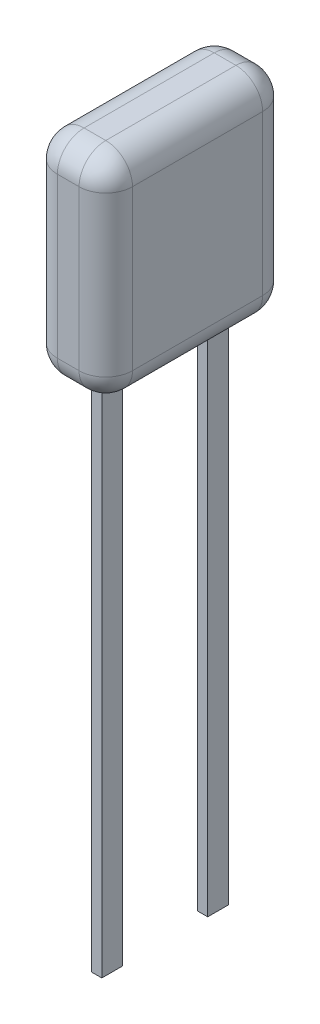
from build123d import *

# Parameters (mm, degrees)
BOSS_EXTRUDE1_DEPTH        = 1.8
FILLET1_R                  = 0.64
BOSS_EXTRUDE2_DEPTH        = 0.125
BOSS_EXTRUDE2_DEPTH_BACK   = 0.125
SKETCH2_R                  = 0.221694952
BOSS_EXTRUDE2_2_DEPTH      = 0.125
BOSS_EXTRUDE2_2_DEPTH_BACK = 0.125
SKETCH2_R_2                = 0.228124389


with BuildPart() as part:
    # Sketch1 → Boss-Extrude1 (new body)
    with BuildSketch(Plane(origin=(0, 0, 0), x_dir=(0, 0, -1), z_dir=(1, 0, 0))):
        with BuildLine():
            Line((-1.56, 2.55), (1.56, 2.55))
            ThreePointArc((1.56, 2.55), (2.01254834, 2.36254834), (2.2, 1.91))
            Line((2.2, 1.91), (2.2, -1.91))
            ThreePointArc((2.2, -1.91), (2.01254834, -2.36254834), (1.56, -2.55))
            Line((1.56, -2.55), (-1.56, -2.55))
            ThreePointArc((-1.56, -2.55), (-2.01254834, -2.36254834), (-2.2, -1.91))
            Line((-2.2, -1.91), (-2.2, 1.91))
            ThreePointArc((-2.2, 1.91), (-2.01254834, 2.36254834), (-1.56, 2.55))
        make_face()
    extrude(amount=BOSS_EXTRUDE1_DEPTH)

    # Fillet1
    fillet1_edges = [part.edges().sort_by_distance(p)[0] for p in [
        (1.8, -2.36254834, -2.01254834),
        (0, -2.55, 0),
        (0, -2.36254834, 2.01254834),
        (1.8, 0, -2.2),
        (1.8, 2.36254834, -2.01254834),
        (1.8, 2.55, 0),
        (1.8, 2.36254834, 2.01254834),
        (1.8, 0, 2.2),
        (1.8, -2.36254834, 2.01254834),
        (1.8, -2.55, 0),
        (0, 0, 2.2),
        (0, 2.36254834, 2.01254834),
        (0, 2.55, 0),
        (0, 2.36254834, -2.01254834),
        (0, 0, -2.2),
        (0, -2.36254834, -2.01254834),
    ]]
    fillet(fillet1_edges, radius=FILLET1_R)


with BuildPart() as body_2:
    # Sketch2 → Boss-Extrude2 (new, two sides: drawn at the far end of the back side and taken through both)
    with BuildSketch(Plane(origin=(0.9, 0, 0), x_dir=(0, 0, -1), z_dir=(1, 0, 0)).offset(-BOSS_EXTRUDE2_DEPTH_BACK)):
        Polygon((1.019106057, -14.926003362), (1.519901832, -14.926003362), (1.519901832, -10.343869193), (1.519901832, -1.501575177), (1.519901832, 1.91), (-1.56, 1.91), (-1.56, -1.341377057), (0.438562537, -1.341377057), (1.019106057, -2.263381464), align=None)
        with Locations((1.079355018, -1.581674238)):
            Circle(SKETCH2_R, mode=Mode.SUBTRACT)
    extrude(amount=BOSS_EXTRUDE2_DEPTH + BOSS_EXTRUDE2_DEPTH_BACK)


with BuildPart() as body_3:
    # Sketch2 → Boss-Extrude2 2 (new, two sides: drawn at the far end of the back side and taken through both)
    with BuildSketch(Plane(origin=(0.9, 0, 0), x_dir=(0, 0, -1), z_dir=(1, 0, 0)).offset(-BOSS_EXTRUDE2_2_DEPTH_BACK)):
        Polygon((-1.019106057, -2.263381464), (-0.353528169, -1.998409357), (-0.353528169, -1.501575177), (-1.519901832, -1.501575177), (-1.519901832, -10.343869193), (-1.519901832, -14.926003362), (-1.019106057, -14.926003362), align=None)
        with Locations((-1.019106057, -1.857571)):
            Circle(SKETCH2_R_2, mode=Mode.SUBTRACT)
    extrude(amount=BOSS_EXTRUDE2_2_DEPTH + BOSS_EXTRUDE2_2_DEPTH_BACK)


solid = Compound([part.part, body_2.part, body_3.part])
